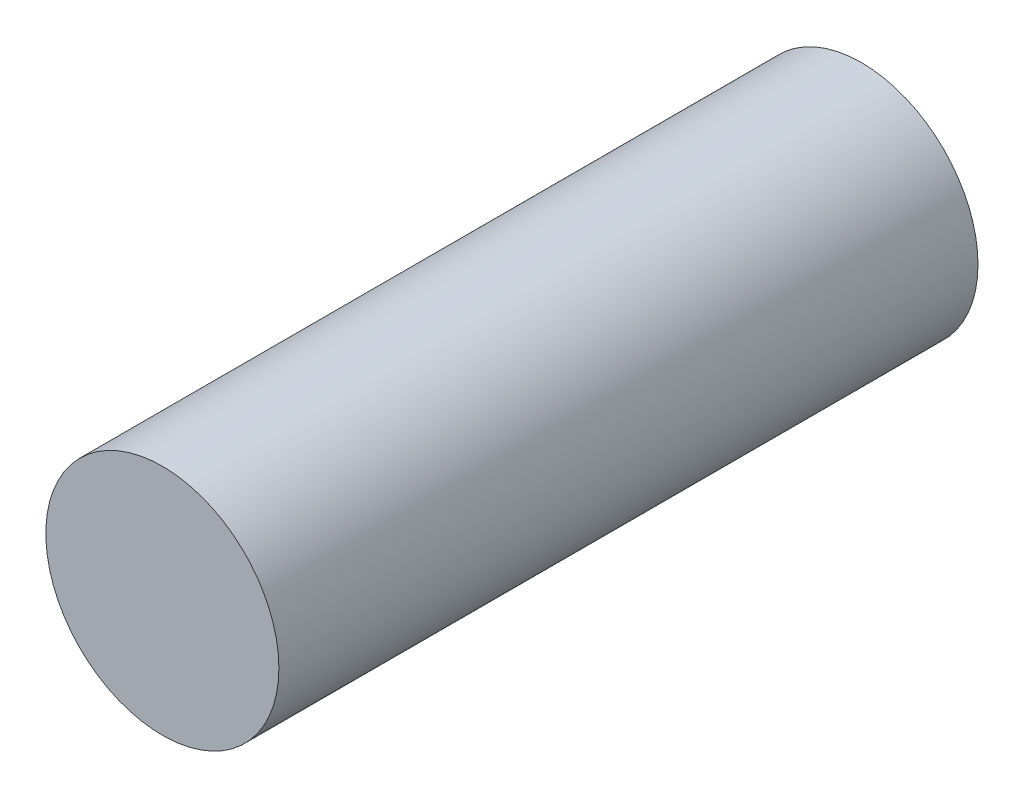
from build123d import *

# Parameters (mm, degrees)
SKETCH_1_R      = 15
EXTRUDE_1_DEPTH = 90


with BuildPart() as part:
    # 草图1 → 凸台-拉伸1 (new body)
    with BuildSketch(Plane.XY):
        with Locations((-120.238104214, 50.185071192)):
            Circle(SKETCH_1_R)
    extrude(amount=-EXTRUDE_1_DEPTH)


solid = part.part
